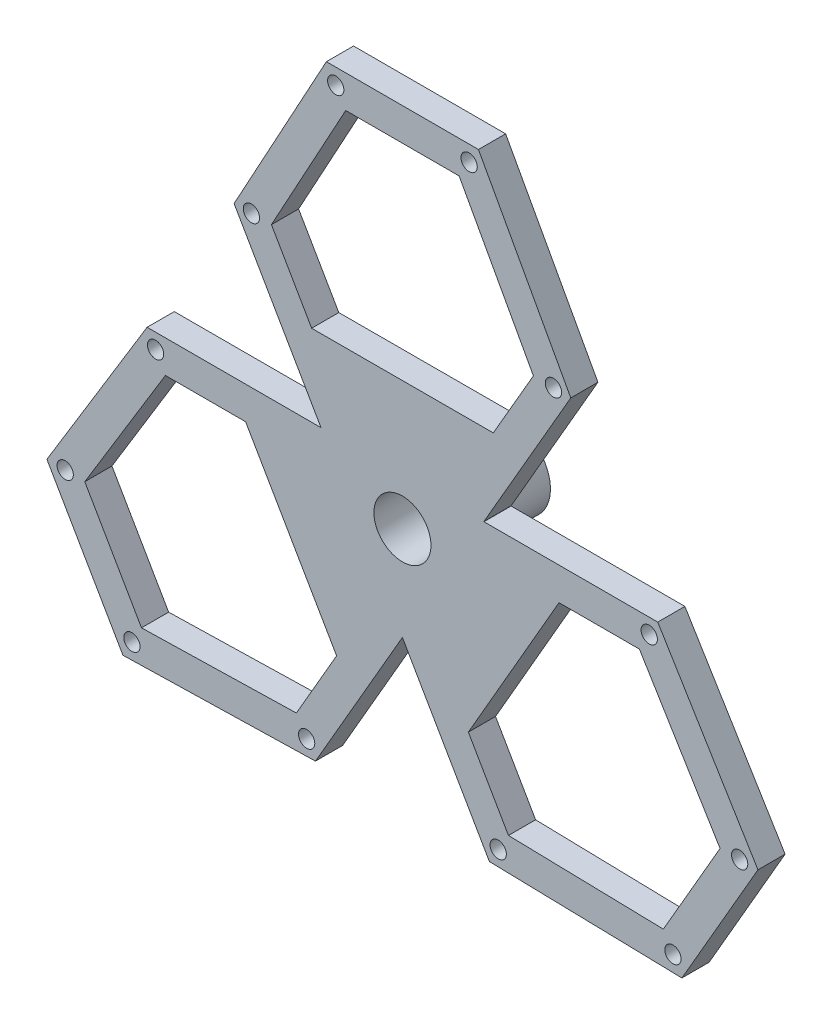
from build123d import *

# Parameters (mm, degrees)
BOSS_EXTRUDE1_DEPTH = 5
CUT_EXTRUDE1_DEPTH  = 95.158544522
SKETCH6_R           = 7.25
BOSS_EXTRUDE3_DEPTH = 15
SKETCH3_R           = 5.25
CUT_EXTRUDE2_DEPTH  = 20
SKETCH5_R           = 1.5
CUT_EXTRUDE3_DEPTH  = 5
CUT_EXTRUDE4_START  = -2.5
SKETCH8_R           = 11
SKETCH8_R_2         = 7.25
CUT_EXTRUDE4_DEPTH  = 2.5


with BuildPart() as part:
    # Sketch1 → Boss-Extrude1 (new body)
    with BuildSketch(Plane.XY):
        Polygon((-30.995, 36.381727213), (-14, 67.5), (14, 67.5), (30.995, 36.381727213), (14.995, 8.668914292), (15, 8.660254038), (15.005, 8.651593784), (47.005, 8.651593784), (65.456714755, -21.625644347), (51.456714755, -45.874355653), (16.01, -45.033320997), (0.01, -17.320508076), (0, -17.320508076), (-0.01, -17.320508076), (-16.01, -45.033320997), (-51.456714755, -45.874355653), (-65.456714755, -21.625644347), (-47.005, 8.651593784), (-15.005, 8.651593784), (-15, 8.660254038), (-14.995, 8.668914292), align=None)
    extrude(amount=BOSS_EXTRUDE1_DEPTH)

    # Sketch2 → Cut-Extrude1 (cut, through all)
    with BuildSketch(Plane.XY.offset(5)):
        Polygon((-28.872149716, 2.651593784), (-12.118974925, -26.293867874), (-19.521225678, -39.114942267), (-48.040387098, -39.791608731), (-58.480737567, -21.708391269), (-43.63514651, 2.651593784), align=None)
        Polygon((-24.113920832, 36.463348484), (-16.71167008, 23.64227409), (16.732422435, 23.678218224), (24.113920832, 36.463348484), (10.440350469, 61.5), (-10.440350469, 61.5), align=None)
        Polygon((43.63514651, 2.651593784), (28.830645005, 2.651593784), (12.139727281, -26.329812008), (19.521225678, -39.114942267), (48.040387098, -39.791608731), (58.480737567, -21.708391269), align=None)
    extrude(amount=-CUT_EXTRUDE1_DEPTH, mode=Mode.SUBTRACT)

    # Sketch6 → Boss-Extrude3 (add)
    with BuildSketch(Plane(origin=(0, 0, 0), x_dir=(-1, 0, 0), z_dir=(0, 0, -1))):
        with Locations(Location((0, 0, 0), (0, 0, 180))):
            Circle(SKETCH6_R)
    extrude(amount=BOSS_EXTRUDE3_DEPTH)

    # Sketch3 → Cut-Extrude2 (cut)
    with BuildSketch(Plane(origin=(0, 0, -15), x_dir=(-1, 0, 0), z_dir=(0, 0, -1))):
        Circle(SKETCH3_R)
    extrude(amount=-CUT_EXTRUDE2_DEPTH, mode=Mode.SUBTRACT)

    # Sketch5 → Cut-Extrude3 (cut)
    with BuildSketch(Plane.XY.offset(5)):
        with Locations((-45.443044798, 5.870544436)):
            Circle(SKETCH5_R)
        with Locations((-62.08538883, -21.665632507)):
            Circle(SKETCH5_R)
        with Locations((-49.805684066, -42.93470506)):
            Circle(SKETCH5_R)
        with Locations((-17.637483295, -42.290100822)):
            Circle(SKETCH5_R)
        with Locations((27.80556106, 36.419560852)):
            Circle(SKETCH5_R)
        with Locations((12.279704321, 64.600342034)):
            Circle(SKETCH5_R)
        with Locations((-12.279705207, 64.600342034)):
            Circle(SKETCH5_R)
        with Locations((-27.805561947, 36.419560852)):
            Circle(SKETCH5_R)
        with Locations((17.637482409, -42.290100822)):
            Circle(SKETCH5_R)
        with Locations((49.80568318, -42.93470506)):
            Circle(SKETCH5_R)
        with Locations((62.085387944, -21.665632507)):
            Circle(SKETCH5_R)
        with Locations((45.443043912, 5.870544436)):
            Circle(SKETCH5_R)
    extrude(amount=-CUT_EXTRUDE3_DEPTH, mode=Mode.SUBTRACT)

    # Sketch8 → Cut-Extrude4 (cut)
    with BuildSketch(Plane(origin=(0, 0, 0), x_dir=(-1, 0, 0), z_dir=(0, 0, -1)).offset(CUT_EXTRUDE4_START)):
        Circle(SKETCH8_R)
        Circle(SKETCH8_R_2, mode=Mode.SUBTRACT)
    extrude(amount=CUT_EXTRUDE4_DEPTH, mode=Mode.SUBTRACT)


solid = part.part
